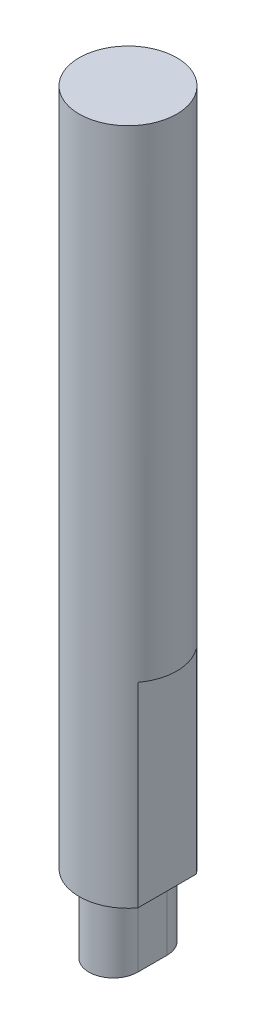
from build123d import *

# Parameters (mm, degrees)
SKETCH1_R           = 2.5
BOSS_EXTRUDE1_DEPTH = 50
BOSS_EXTRUDE2_START = 8.295452371
SKETCH2_R           = 2.5
BOSS_EXTRUDE2_DEPTH = 8.295452371
SKETCH4_OUTSIDE_W   = 18.744
SKETCH4_OUTSIDE_H   = 18.744
CUT_EXTRUDE1_DEPTH  = 3.6
CUT_EXTRUDE2_DEPTH  = 10
CUT_EXTRUDE3_START  = -20
SKETCH7_R           = 2.5
CUT_EXTRUDE3_DEPTH  = 20


with BuildPart() as part:
    # Sketch1 → Boss-Extrude1 (new body)
    with BuildSketch(Plane(origin=(0, 0, 0), x_dir=(1, 0, 0), z_dir=(0, 1, 0))):
        with Locations(Location((0, 0, 0), (0, 0, 270))):
            Circle(SKETCH1_R)
    extrude(amount=BOSS_EXTRUDE1_DEPTH)

    # Sketch2 → Boss-Extrude2 (add)
    with BuildSketch(Plane(origin=(0, 0, 0), x_dir=(-1, 0, 0), z_dir=(0, -1, 0)).offset(BOSS_EXTRUDE2_START)):
        with Locations(Location((0, 0, 0), (0, 0, 270))):
            Circle(SKETCH2_R)
    extrude(amount=-BOSS_EXTRUDE2_DEPTH)

    # Sketch4 outside → Cut-Extrude1 (cut)
    with BuildSketch(Plane.XZ.offset(8.295452371)):
        Rectangle(SKETCH4_OUTSIDE_W, SKETCH4_OUTSIDE_H)
        with BuildLine():
            Line((1.25, 0.75), (1.25, -0.75))
            ThreePointArc((1.25, -0.75), (0, -2), (-1.25, -0.75))
            Line((-1.25, -0.75), (-1.25, 0.75))
            ThreePointArc((-1.25, 0.75), (0, 2), (1.25, 0.75))
        make_face(mode=Mode.SUBTRACT)
    extrude(amount=-CUT_EXTRUDE1_DEPTH, mode=Mode.SUBTRACT)

    # Sketch5 → Cut-Extrude2 (cut)
    with BuildSketch(Plane(origin=(0, -4.695452371, 0), x_dir=(-1, 0, 0), z_dir=(0, -1, 0))):
        with BuildLine():
            Line((2, -1.5), (2, 1.5))
            ThreePointArc((2, 1.5), (2.5, 0), (2, -1.5))
        make_face()
        with BuildLine():
            Line((-2, -1.5), (-2, 1.5))
            ThreePointArc((-2, 1.5), (-2.5, 0), (-2, -1.5))
        make_face()
    extrude(amount=-CUT_EXTRUDE2_DEPTH, mode=Mode.SUBTRACT)

    # Sketch7 → Cut-Extrude3 (cut)
    with BuildSketch(Plane(origin=(0, 50, 0), x_dir=(1, 0, 0), z_dir=(0, 1, 0)).offset(CUT_EXTRUDE3_START)):
        with Locations(Location((0, 0, 0), (0, 0, 143.130102354))):
            Circle(SKETCH7_R)
    extrude(amount=CUT_EXTRUDE3_DEPTH, mode=Mode.SUBTRACT)


solid = part.part
